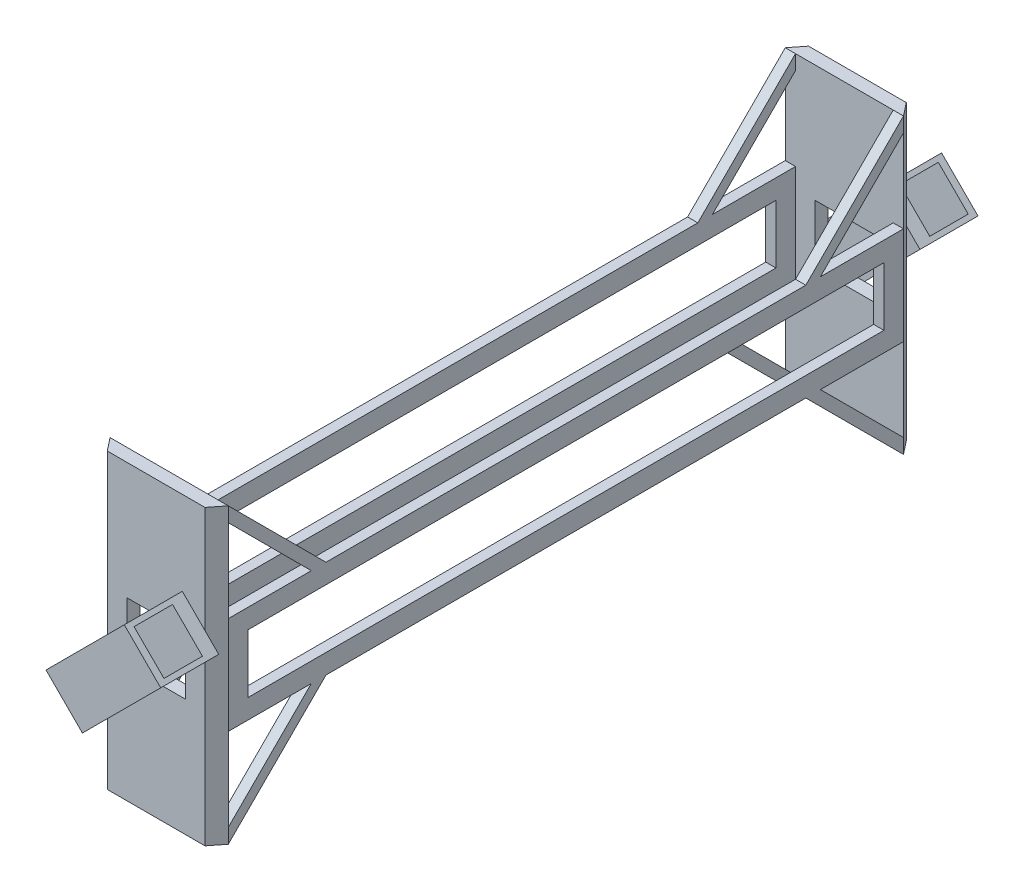
from build123d import *

# Parameters (mm, degrees)
SKETCH1_W             = 38.1
SKETCH1_H             = 38.1
BOSS_EXTRUDE1_DEPTH   = 5.08
SKETCH2_W             = 4
SKETCH2_H             = 38.1
BOSS_EXTRUDE2_DEPTH   = 263.31036223
BOSS_EXTRUDE2_2_DEPTH = 263.31036223
BOSS_EXTRUDE4_DEPTH   = 38.1
SKETCH5_W             = 22.86
SKETCH5_H             = 22.86
CUT_EXTRUDE1_DEPTH    = 354.24236223
SKETCH6_W             = 248.07036223
SKETCH6_H             = 22.86
CUT_EXTRUDE2_DEPTH    = 354.24236223
BOSS_EXTRUDE5_DEPTH   = 38.1
BOSS_EXTRUDE6_DEPTH   = 4
MIRROR9_COPY_1_DEPTH  = 4
BOSS_EXTRUDE8_DEPTH   = 5.08
BOSS_EXTRUDE9_DEPTH   = 15
BOSS_EXTRUDE10_DEPTH  = 2.54


with BuildPart() as part:
    # Sketch1 → Boss-Extrude1 (new body)
    with BuildSketch(Plane.XY):
        Rectangle(SKETCH1_W, SKETCH1_H)
    extrude(amount=BOSS_EXTRUDE1_DEPTH)



with BuildPart() as body_2:
    # Sketch2 → Boss-Extrude2 (new body)
    with BuildSketch(Plane(origin=(0, 0, 0), x_dir=(-1, 0, 0), z_dir=(0, 0, -1))):
        with Locations((21.05, 0)):
            Rectangle(SKETCH2_W, SKETCH2_H)
    extrude(amount=BOSS_EXTRUDE2_DEPTH)


with BuildPart() as body_3:
    # Sketch2 → Boss-Extrude2 2 (new body)
    with BuildSketch(Plane(origin=(0, 0, 0), x_dir=(-1, 0, 0), z_dir=(0, 0, -1))):
        with Locations((-21.05, 0)):
            Rectangle(SKETCH2_W, SKETCH2_H)
    extrude(amount=BOSS_EXTRUDE2_2_DEPTH)


with BuildPart() as part_1:
    add(part.part)

    add(body_2.part)  # Boss-Extrude4 merges body 2

    add(body_3.part)  # Boss-Extrude4 merges body 3
    # Sketch4 → Boss-Extrude4 (add)
    with BuildSketch(Plane(origin=(0, 19.05, 0), x_dir=(1, 0, 0), z_dir=(0, 1, 0))):
        Polygon((23.05, 0), (19.05, -5.08), (19.05, 0), align=None)
        Polygon((-19.05, 0), (-19.05, -5.08), (-23.05, 0), align=None)
    extrude(amount=-BOSS_EXTRUDE4_DEPTH)

    # Mirror2: part across plane


with BuildPart() as part_2:
    add(part_1.part)
    add(part_1.part.mirror(Plane(origin=(0, 0, -131.655181115), x_dir=(1, 0, 0), z_dir=(0, 0, -1))))

    # Sketch5 → Cut-Extrude1 (cut)
    with BuildSketch(Plane.XY.offset(5.08)):
        Rectangle(SKETCH5_W, SKETCH5_H)
    extrude(amount=-CUT_EXTRUDE1_DEPTH, mode=Mode.SUBTRACT)

    # Sketch6 → Cut-Extrude2 (cut)
    with BuildSketch(Plane.ZY.offset(23.05)):
        with Locations((-131.655181115, 0)):
            Rectangle(SKETCH6_W, SKETCH6_H)
    extrude(amount=-CUT_EXTRUDE2_DEPTH, mode=Mode.SUBTRACT)

    # Sketch7 → Boss-Extrude5 (add)
    with BuildSketch(Plane(origin=(0, 19.05, 0), x_dir=(1, 0, 0), z_dir=(0, 1, 0))):
        Polygon((-19.05, 0), (-23.05, 0), (-19.05, -5.08), (19.05, -5.08), (23.05, 0), (19.05, 0), align=None)
        Polygon((19.05, 268.39036223), (23.05, 263.31036223), (19.05, 263.31036223), (-19.05, 263.31036223), (-23.05, 263.31036223), (-19.05, 268.39036223), align=None)
    boss_extrude5 = extrude(amount=BOSS_EXTRUDE5_DEPTH)

    # Sketch8 → Boss-Extrude6 (add)
    with BuildSketch(Plane.ZY.offset(23.05)):
        Polygon((0, 57.15), (-38.1, 19.05), (-32.395584898, 19.05), (0, 51.445584898), align=None)
        Polygon((-230.914777332, 19.05), (-263.31036223, 51.445584898), (-263.31036223, 57.15), (-225.21036223, 19.05), align=None)
    boss_extrude6 = extrude(amount=-BOSS_EXTRUDE6_DEPTH)

    # Mirror8: Boss-Extrude6 across plane
    add(boss_extrude6.mirror(Plane(origin=(0, 0, 0), x_dir=(0, 0, 1), z_dir=(1, 0, 0))))

    # Mirror9: Boss-Extrude5, Boss-Extrude6 across plane
    add(boss_extrude5.mirror(Plane.ZX))
    add(boss_extrude6.mirror(Plane.ZX))

    # Mirror9 copy 1 sketch → Mirror9 copy 1 (add)
    with BuildSketch(Plane(origin=(23.05, 0, 0), x_dir=(0, 0, 1), z_dir=(1, 0, 0))):
        Polygon((0, 57.15), (-38.1, 19.05), (-32.395584898, 19.05), (0, 51.445584898), align=None)
        Polygon((-230.914777332, 19.05), (-263.31036223, 51.445584898), (-263.31036223, 57.15), (-225.21036223, 19.05), align=None)
    extrude(amount=-MIRROR9_COPY_1_DEPTH)

    # Sketch11 → Boss-Extrude8 (add)
    with BuildSketch(Plane.XY.offset(5.08)):
        Polygon((-18.529352083, -7.922750365), (-7.922750365, -18.529352083), (-6.126699141, -20.325403307), (24.406171671, 10.207467504), (10.207467504, 24.406171671), (8.41141628, 22.610120446), (-20.325403307, -6.126699141), align=None)
    boss_extrude8 = extrude(amount=BOSS_EXTRUDE8_DEPTH)

    # Sketch12 → Boss-Extrude9 (add)
    with BuildSketch(Plane.XY.offset(10.16)):
        Polygon((24.406171671, 10.207467504), (-6.126699141, -20.325403307), (-20.325403307, -6.126699141), (10.207467504, 24.406171671), (11.477467504, 23.136171671), (10.207467504, 21.866171671), (-17.785403307, -6.126699141), (-6.126699141, -17.785403307), (21.866171671, 10.207467504), (23.136171671, 11.477467504), align=None)
    boss_extrude9 = extrude(amount=BOSS_EXTRUDE9_DEPTH)

    # Sketch13 → Boss-Extrude10 (add)
    with BuildSketch(Plane.XY.offset(25.16)):
        Polygon((-20.325403307, -6.126699141), (10.207467504, 24.406171671), (24.406171671, 10.207467504), (-6.126699141, -20.325403307), align=None)
    boss_extrude10 = extrude(amount=BOSS_EXTRUDE10_DEPTH)

    # Mirror12: Boss-Extrude8, Boss-Extrude9, Boss-Extrude10 across plane
    add(boss_extrude8.mirror(Plane(origin=(0, 0, -131.655181115), x_dir=(1, 0, 0), z_dir=(0, 0, -1))))
    add(boss_extrude9.mirror(Plane(origin=(0, 0, -131.655181115), x_dir=(1, 0, 0), z_dir=(0, 0, -1))))
    add(boss_extrude10.mirror(Plane(origin=(0, 0, -131.655181115), x_dir=(1, 0, 0), z_dir=(0, 0, -1))))


solid = part_2.part
